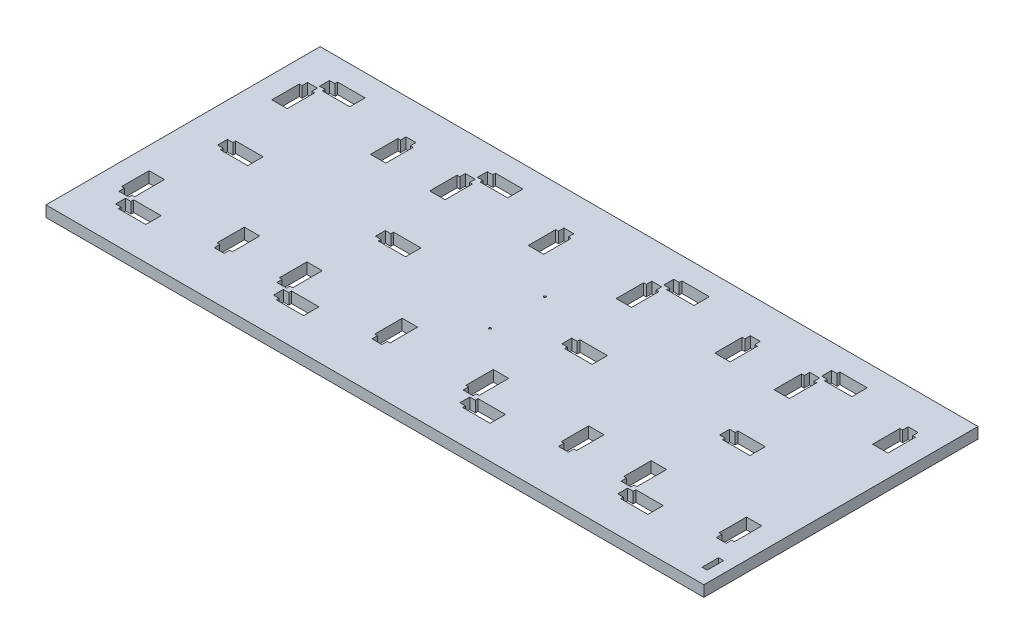
from build123d import *

# Parameters (mm, degrees)
SKETCH1_W           = 600
SKETCH1_H           = 250
SKETCH1_R           = 1
SKETCH1_W_2         = 4.648154018
SKETCH1_H_2         = 15
BOSS_EXTRUDE3_DEPTH = 10


with BuildPart() as part:
    # Sketch1 → Boss-Extrude3 (new body)
    with BuildSketch(Plane(origin=(0, 0, 0), x_dir=(1, 0, 0), z_dir=(0, 1, 0))):
        with Locations((300, -125)):
            Rectangle(SKETCH1_W, SKETCH1_H)
        with Locations(Location((300, -95, 0), (0, 0, 270))):
            Circle(SKETCH1_R, mode=Mode.SUBTRACT)
        with Locations(Location((300, -145, 0), (0, 0, 270))):
            Circle(SKETCH1_R, mode=Mode.SUBTRACT)
        Polygon((36, -113), (61, -113), (61, -127), (36, -127), (36, -124.5), (31, -124.5), (31, -115.5), (36, -115.5), align=None, mode=Mode.SUBTRACT)
        Polygon((36, -20), (61, -20), (61, -34), (36, -34), (36, -31.5), (31, -31.5), (31, -22.5), (36, -22.5), align=None, mode=Mode.SUBTRACT)
        Polygon((36, -206), (61, -206), (61, -220), (36, -220), (36, -217.5), (31, -217.5), (31, -208.5), (36, -208.5), align=None, mode=Mode.SUBTRACT)
        Polygon((20, -39), (20, -64), (34, -64), (34, -39), (31.5, -39), (31.5, -34), (22.5, -34), (22.5, -39), align=None, mode=Mode.SUBTRACT)
        Polygon((108, -37.094845711), (108, -62.094845711), (122, -62.094845711), (122, -37.094845711), (119.5, -37.094845711), (119.5, -32.094845711), (110.5, -32.094845711), (110.5, -37.094845711), align=None, mode=Mode.SUBTRACT)
        Polygon((20, -176), (34, -176), (34, -203), (31.5, -203), (31.5, -206), (22.5, -206), (22.5, -201), (20, -201), align=None, mode=Mode.SUBTRACT)
        Polygon((108, -177.091528377), (122, -177.091528377), (122, -202.091528377), (119.5, -202.091528377), (119.5, -207.091528377), (110.5, -207.091528377), (110.5, -202.091528377), (108, -202.091528377), align=None, mode=Mode.SUBTRACT)
        Polygon((179.962604404, -31.5), (179.962604404, -34), (204.962604404, -34), (204.962604404, -20), (179.962604404, -20), (179.962604404, -22.5), (174.962604404, -22.5), (174.962604404, -31.5), align=None, mode=Mode.SUBTRACT)
        Polygon((263.462604404, -37.094845711), (265.962604404, -37.094845711), (265.962604404, -62.094845711), (251.962604404, -62.094845711), (251.962604404, -37.094845711), (254.462604404, -37.094845711), (254.462604404, -32.094845711), (263.462604404, -32.094845711), align=None, mode=Mode.SUBTRACT)
        Polygon((175.462604404, -39), (177.962604404, -39), (177.962604404, -64), (163.962604404, -64), (163.962604404, -39), (166.462604404, -39), (166.462604404, -34), (175.462604404, -34), align=None, mode=Mode.SUBTRACT)
        Polygon((179.962604404, -124.5), (179.962604404, -127), (204.962604404, -127), (204.962604404, -113), (179.962604404, -113), (179.962604404, -115.5), (174.962604404, -115.5), (174.962604404, -124.5), align=None, mode=Mode.SUBTRACT)
        Polygon((263.462604404, -202.091528377), (265.962604404, -202.091528377), (265.962604404, -177.091528377), (251.962604404, -177.091528377), (251.962604404, -202.091528377), (254.462604404, -202.091528377), (254.462604404, -207.091528377), (263.462604404, -207.091528377), align=None, mode=Mode.SUBTRACT)
        Polygon((175.462604404, -203), (177.962604404, -203), (177.962604404, -176), (163.962604404, -176), (163.962604404, -201), (166.462604404, -201), (166.462604404, -206), (175.462604404, -206), align=None, mode=Mode.SUBTRACT)
        Polygon((179.962604404, -217.5), (179.962604404, -220), (204.962604404, -220), (204.962604404, -206), (179.962604404, -206), (179.962604404, -208.5), (174.962604404, -208.5), (174.962604404, -217.5), align=None, mode=Mode.SUBTRACT)
        Polygon((350, -31.5), (350, -34), (375, -34), (375, -20), (350, -20), (350, -22.5), (345, -22.5), (345, -31.5), align=None, mode=Mode.SUBTRACT)
        with Locations((587.675922991, -229.5)):
            Rectangle(SKETCH1_W_2, SKETCH1_H_2, mode=Mode.SUBTRACT)
        Polygon((433.5, -37.094845711), (436, -37.094845711), (436, -62.094845711), (422, -62.094845711), (422, -37.094845711), (424.5, -37.094845711), (424.5, -32.094845711), (433.5, -32.094845711), align=None, mode=Mode.SUBTRACT)
        Polygon((345.5, -39), (348, -39), (348, -64), (334, -64), (334, -39), (336.5, -39), (336.5, -34), (345.5, -34), align=None, mode=Mode.SUBTRACT)
        Polygon((350, -124.5), (350, -127), (375, -127), (375, -113), (350, -113), (350, -115.5), (345, -115.5), (345, -124.5), align=None, mode=Mode.SUBTRACT)
        Polygon((433.5, -202.091528377), (436, -202.091528377), (436, -177.091528377), (422, -177.091528377), (422, -202.091528377), (424.5, -202.091528377), (424.5, -207.091528377), (433.5, -207.091528377), align=None, mode=Mode.SUBTRACT)
        Polygon((345.5, -203), (348, -203), (348, -176), (334, -176), (334, -201), (336.5, -201), (336.5, -206), (345.5, -206), align=None, mode=Mode.SUBTRACT)
        Polygon((350, -217.5), (350, -220), (375, -220), (375, -206), (350, -206), (350, -208.5), (345, -208.5), (345, -217.5), align=None, mode=Mode.SUBTRACT)
        Polygon((489.462604404, -203), (491.962604404, -203), (491.962604404, -176), (477.962604404, -176), (477.962604404, -201), (480.462604404, -201), (480.462604404, -206), (489.462604404, -206), align=None, mode=Mode.SUBTRACT)
        Polygon((493.962604404, -217.5), (493.962604404, -220), (518.962604404, -220), (518.962604404, -206), (493.962604404, -206), (493.962604404, -208.5), (488.962604404, -208.5), (488.962604404, -217.5), align=None, mode=Mode.SUBTRACT)
        Polygon((577.462604404, -202.091528377), (579.962604404, -202.091528377), (579.962604404, -177.091528377), (565.962604404, -177.091528377), (565.962604404, -202.091528377), (568.462604404, -202.091528377), (568.462604404, -207.091528377), (577.462604404, -207.091528377), align=None, mode=Mode.SUBTRACT)
        Polygon((493.962604404, -124.5), (493.962604404, -127), (518.962604404, -127), (518.962604404, -113), (493.962604404, -113), (493.962604404, -115.5), (488.962604404, -115.5), (488.962604404, -124.5), align=None, mode=Mode.SUBTRACT)
        Polygon((489.462604404, -39), (491.962604404, -39), (491.962604404, -64), (477.962604404, -64), (477.962604404, -39), (480.462604404, -39), (480.462604404, -34), (489.462604404, -34), align=None, mode=Mode.SUBTRACT)
        Polygon((493.962604404, -31.5), (493.962604404, -34), (518.962604404, -34), (518.962604404, -20), (493.962604404, -20), (493.962604404, -22.5), (488.962604404, -22.5), (488.962604404, -31.5), align=None, mode=Mode.SUBTRACT)
        Polygon((577.462604404, -37.094845711), (579.962604404, -37.094845711), (579.962604404, -62.094845711), (565.962604404, -62.094845711), (565.962604404, -37.094845711), (568.462604404, -37.094845711), (568.462604404, -32.094845711), (577.462604404, -32.094845711), align=None, mode=Mode.SUBTRACT)
    extrude(amount=BOSS_EXTRUDE3_DEPTH)


solid = part.part
